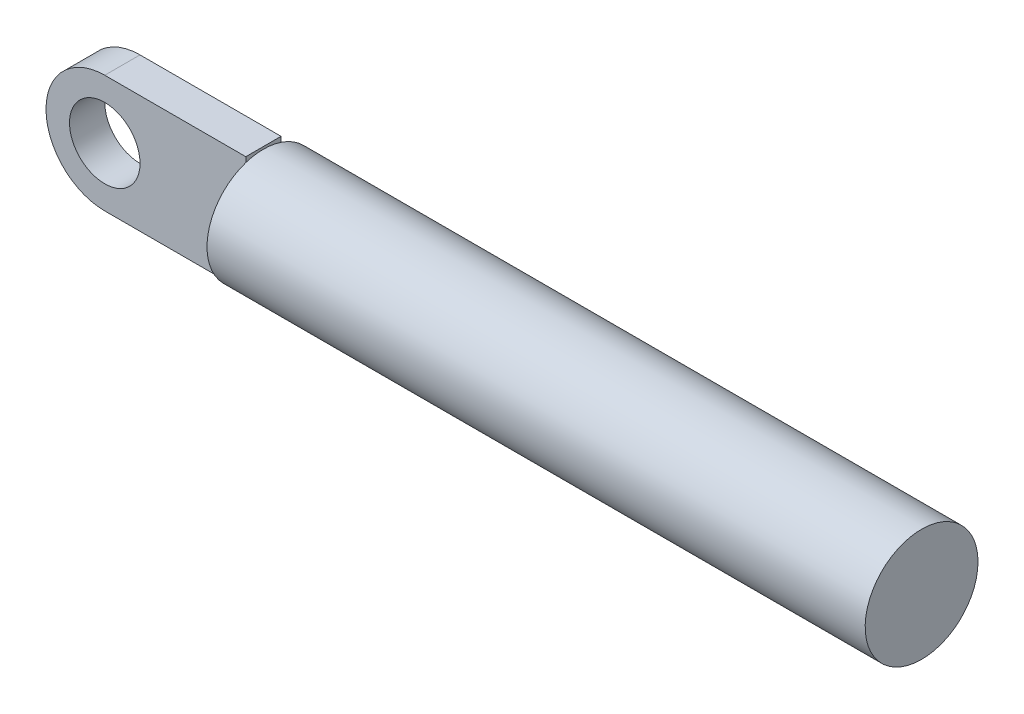
from build123d import *

# Parameters (mm, degrees)
SKETCH_1_R      = 15
EXTRUDE_1_DEPTH = 15
SKETCH_2_R      = 24
EXTRUDE_2_DEPTH = 280
SCALE_1_SCALE   = 0.6


with BuildPart() as part:
    # 草图1 → 凸台-拉伸1 (new body)
    with BuildSketch(Plane.XY):
        with BuildLine():
            Line((0, 25), (60, 25))
            Line((60, 25), (60, -25))
            Line((60, -25), (0, -25))
            ThreePointArc((0, -25), (-25, 0), (0, 25))
        make_face()
        Circle(SKETCH_1_R, mode=Mode.SUBTRACT)
    extrude(amount=EXTRUDE_1_DEPTH)

    # 草图2 → 凸台-拉伸2 (add)
    with BuildSketch(Plane(origin=(60, 0, 0), x_dir=(0, 0, -1), z_dir=(1, 0, 0))):
        with Locations(Location((-7.5, 0, 0), (0, 0, 108.209956864))):
            Circle(SKETCH_2_R)
    extrude(amount=EXTRUDE_2_DEPTH)


with BuildPart() as part_1:
    # 缩放比例1: scaled about (0, 0, 0)
    add(part.part.scale(SCALE_1_SCALE))


solid = part_1.part
